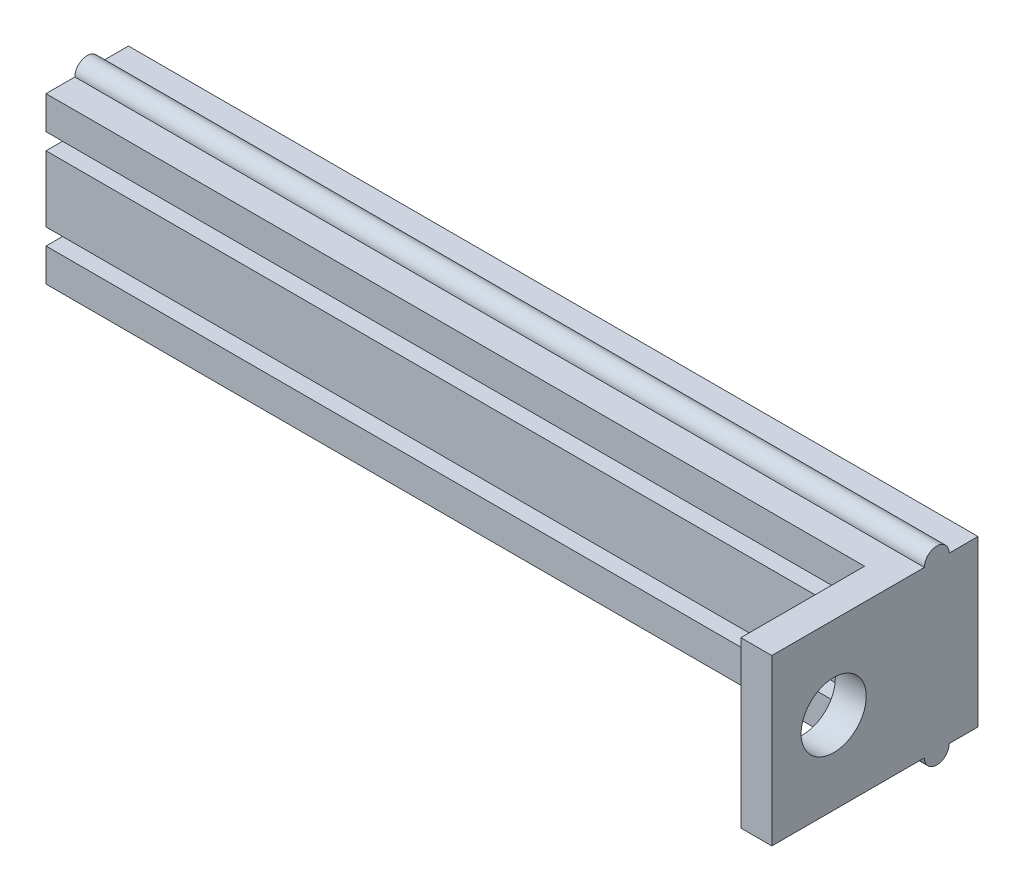
from build123d import *

# Parameters (mm, degrees)
SKETCH1_W           = 206
SKETCH1_H           = 40
BOSS_EXTRUDE1_DEPTH = 20
SKETCH2_W           = 7.5
SKETCH2_H           = 40
BOSS_EXTRUDE2_DEPTH = 30
BOSS_EXTRUDE3_DEPTH = 206
CUT_EXTRUDE1_DEPTH  = 198.5
SKETCH7_R           = 7.9
CUT_EXTRUDE2_DEPTH  = 217.883289147


with BuildPart() as part:
    # Sketch1 → Boss-Extrude1 (new body)
    with BuildSketch(Plane.XY):
        with Locations((-0.375227687, 48.666666667)):
            Rectangle(SKETCH1_W, SKETCH1_H)
    extrude(amount=BOSS_EXTRUDE1_DEPTH)

    # Sketch2 → Boss-Extrude2 (add)
    with BuildSketch(Plane.XY.offset(20)):
        with Locations((98.874772313, 48.666666667)):
            Rectangle(SKETCH2_W, SKETCH2_H)
    extrude(amount=BOSS_EXTRUDE2_DEPTH)

    # Sketch4 → Boss-Extrude3 (add)
    with BuildSketch(Plane.ZY.offset(103.375227687)):
        with BuildLine():
            Line((7, 68.666666667), (13, 68.666666667))
            ThreePointArc((13, 68.666666667), (10, 71.666666667), (7, 68.666666667))
        make_face()
        with BuildLine():
            Line((7, 28.666666667), (13, 28.666666667))
            ThreePointArc((13, 28.666666667), (10, 25.666666667), (7, 28.666666667))
        make_face()
    extrude(amount=-BOSS_EXTRUDE3_DEPTH)

    # Sketch6 → Cut-Extrude1 (cut)
    with BuildSketch(Plane.ZY.offset(103.375227687)):
        Polygon((20, 56.666666667), (20, 60.666666667), (15, 60.666666667), (15, 63.666666667), (10, 63.666666667), (10, 53.666666667), (15, 53.666666667), (15, 56.666666667), align=None)
        Polygon((20, 36.666666667), (20, 40.666666667), (15, 40.666666667), (15, 43.666666667), (10, 43.666666667), (10, 33.666666667), (15, 33.666666667), (15, 36.666666667), align=None)
    extrude(amount=-CUT_EXTRUDE1_DEPTH, mode=Mode.SUBTRACT)

    # Sketch7 → Cut-Extrude2 (cut, through all)
    with BuildSketch(Plane.ZY.offset(-95.124772313)):
        with Locations(Location((35, 48.666666667, 0), (0, 0, 270))):
            Circle(SKETCH7_R)
    extrude(amount=-CUT_EXTRUDE2_DEPTH, mode=Mode.SUBTRACT)


solid = part.part
